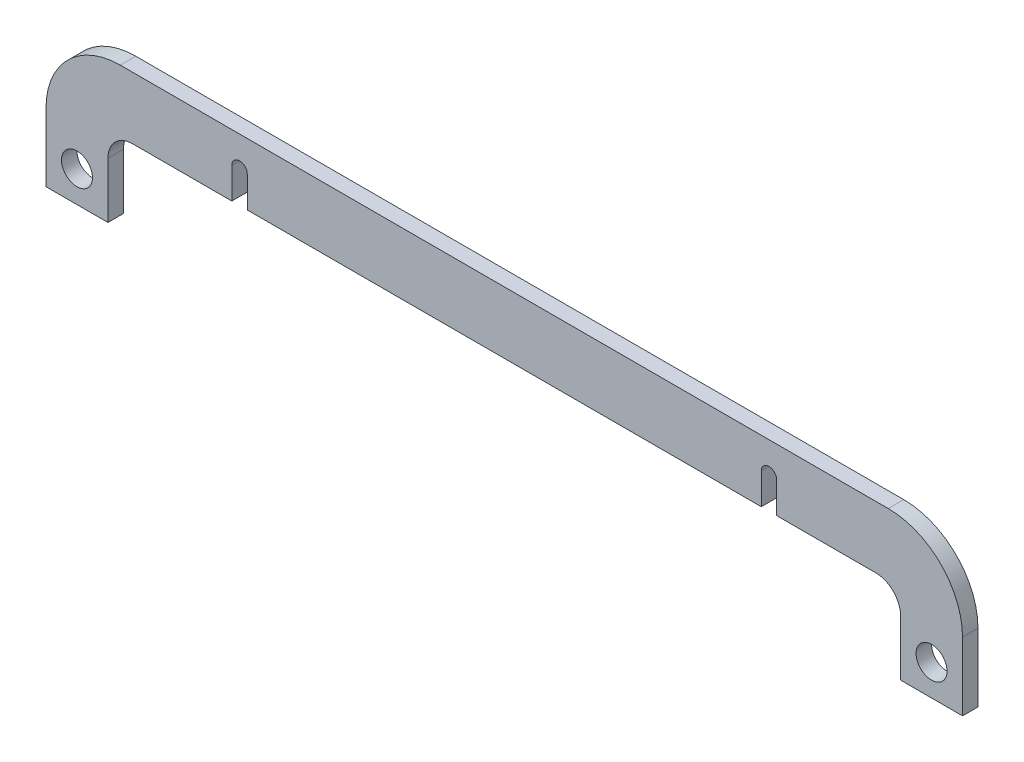
from build123d import *

# Parameters (mm, degrees)
SKETCH1_R           = 1.5875
BOSS_EXTRUDE1_DEPTH = 1.5875


with BuildPart() as part:
    # Sketch1 → Boss-Extrude1 (new body)
    with BuildSketch(Plane.XY):
        with BuildLine():
            Line((-40.64, 20.32), (-40.64, 26.035))
            ThreePointArc((-40.64, 26.035), (-39.896051224, 27.831051224), (-38.1, 28.575))
            Line((-38.1, 28.575), (-27.94, 28.575))
            Line((-27.94, 28.575), (-27.94, 31.75))
            ThreePointArc((-27.94, 31.75), (-27.14625, 32.54375), (-26.3525, 31.75))
            Line((-26.3525, 31.75), (-26.3525, 28.575))
            Line((-26.3525, 28.575), (26.3525, 28.575))
            Line((26.3525, 28.575), (26.3525, 31.75))
            ThreePointArc((26.3525, 31.75), (27.14625, 32.54375), (27.94, 31.75))
            Line((27.94, 31.75), (27.94, 28.575))
            Line((27.94, 28.575), (38.1, 28.575))
            ThreePointArc((38.1, 28.575), (39.896051224, 27.831051224), (40.64, 26.035))
            Line((40.64, 26.035), (40.64, 20.32))
            Line((40.64, 20.32), (46.99, 20.32))
            Line((46.99, 20.32), (46.99, 27.305))
            ThreePointArc((46.99, 27.305), (44.758153673, 32.693153673), (39.37, 34.925))
            Line((39.37, 34.925), (-39.37, 34.925))
            ThreePointArc((-39.37, 34.925), (-44.758153673, 32.693153673), (-46.99, 27.305))
            Line((-46.99, 27.305), (-46.99, 20.32))
            Line((-46.99, 20.32), (-40.64, 20.32))
        make_face()
        with Locations((-43.815, 23.495)):
            Circle(SKETCH1_R, mode=Mode.SUBTRACT)
        with Locations((43.815, 23.495)):
            Circle(SKETCH1_R, mode=Mode.SUBTRACT)
    extrude(amount=BOSS_EXTRUDE1_DEPTH)


solid = part.part
